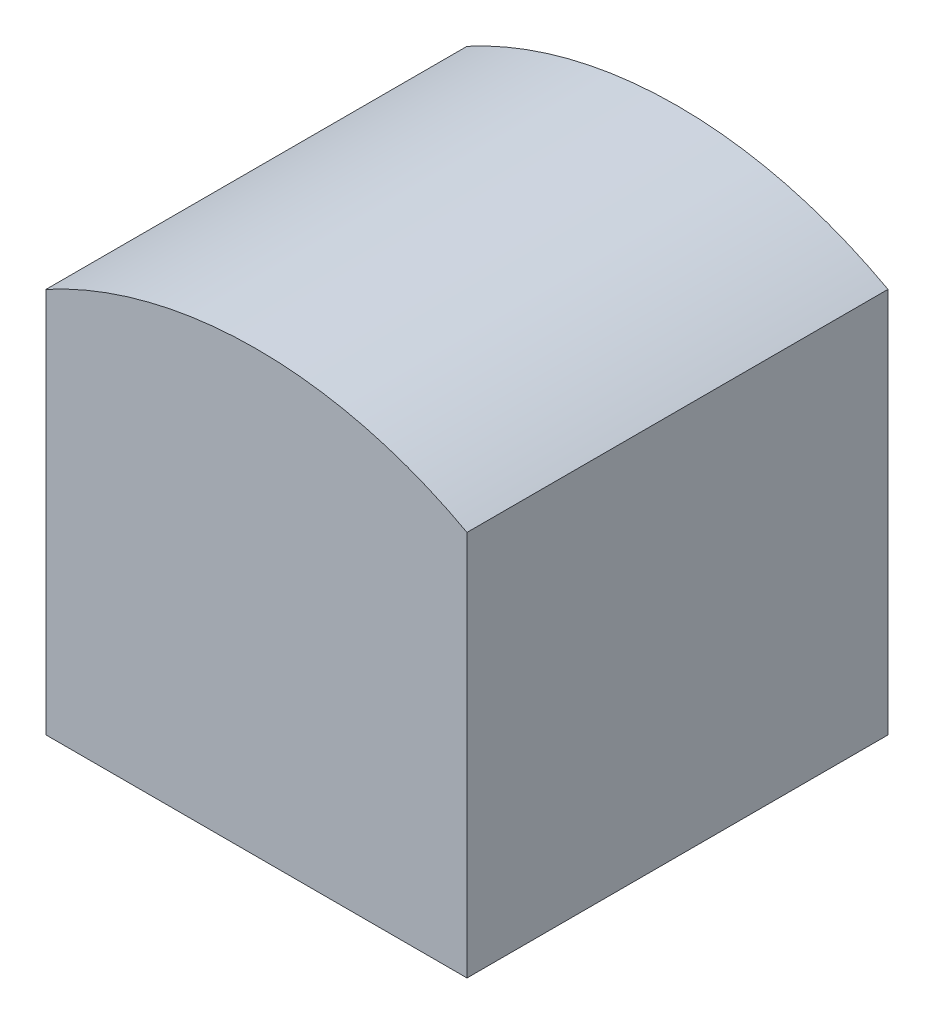
from build123d import *

# Parameters (mm, degrees)
BOSS_EXTRUDE1_DEPTH = 120


with BuildPart() as part:
    # Sketch1 → Boss-Extrude1 (new body)
    with BuildSketch(Plane.XY):
        with BuildLine():
            Line((60, -55), (-60, -55))
            Line((-60, -55), (-60, 55))
            ThreePointArc((-60, 55), (0, 70.299640861), (60, 55))
            Line((60, 55), (60, -55))
        make_face()
    extrude(amount=BOSS_EXTRUDE1_DEPTH)


solid = part.part
